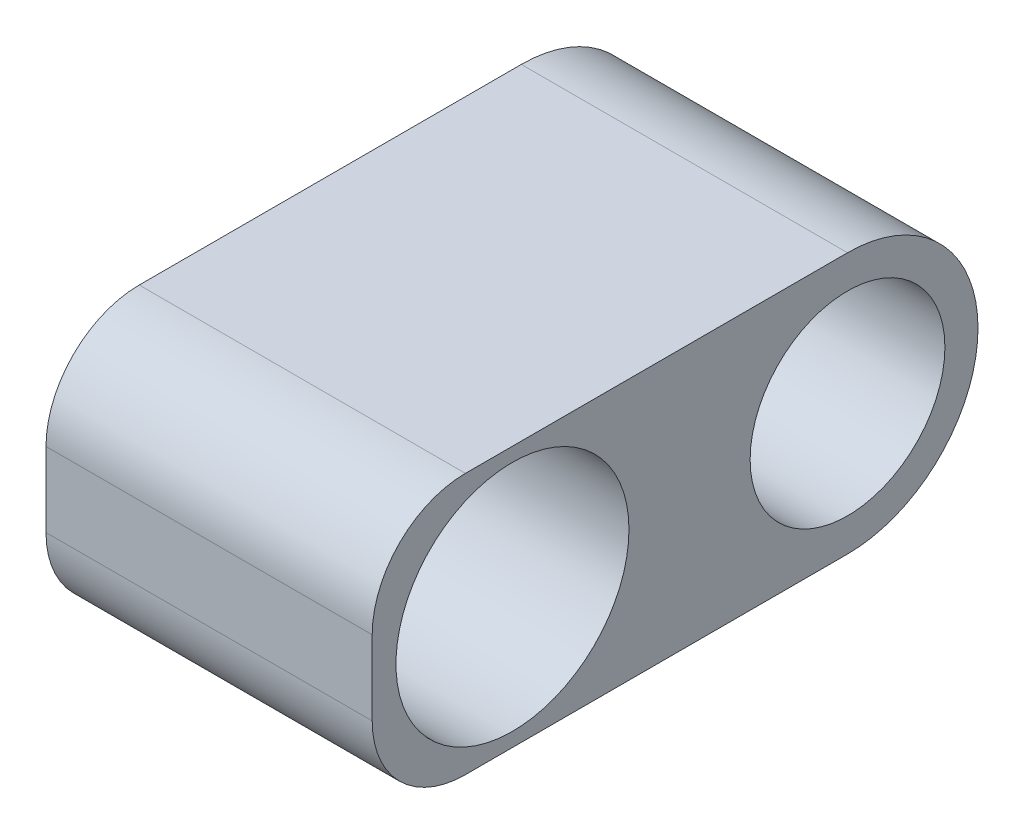
from build123d import *

# Parameters (mm, degrees)
BOSS_EXTRUDE1_START = -17
BOSS_EXTRUDE1_DEPTH = 35
SKETCH2_R           = 10.45
CUT_EXTRUDE1_DEPTH  = 32
SKETCH3_R           = 6.5
CUT_EXTRUDE2_DEPTH  = 62.814237842
SKETCH4_R           = 12.5
CUT_EXTRUDE3_DEPTH  = 64.419239983
FILLET5_R           = 10
FILLET6_R           = 10


with BuildPart() as part:
    # Sketch1 → Boss-Extrude1 (new body)
    with BuildSketch(Plane.YZ.offset(BOSS_EXTRUDE1_START)):
        with BuildLine():
            Line((-14, 0), (-14, 51))
            Line((-14, 51), (14, 51))
            Line((14, 51), (14, 0))
            ThreePointArc((14, 0), (0, -14), (-14, 0))
        make_face()
    extrude(amount=BOSS_EXTRUDE1_DEPTH)

    # Sketch2 → Cut-Extrude1 (cut)
    with BuildSketch(Plane.YZ.offset(18)):
        with Locations(Location((0, 0, 0), (0, 0, 270))):
            Circle(SKETCH2_R)
    extrude(amount=-CUT_EXTRUDE1_DEPTH, mode=Mode.SUBTRACT)

    # Sketch3 → Cut-Extrude2 (cut, through all)
    with BuildSketch(Plane.YZ.offset(-14)):
        with Locations(Location((0, 0, 0), (0, 0, 270))):
            Circle(SKETCH3_R)
    extrude(amount=-CUT_EXTRUDE2_DEPTH, mode=Mode.SUBTRACT)

    # Sketch4 → Cut-Extrude3 (cut, through all)
    with BuildSketch(Plane.YZ.offset(18)):
        with Locations(Location((0, 35.95, 0), (0, 0, 270))):
            Circle(SKETCH4_R)
    extrude(amount=-CUT_EXTRUDE3_DEPTH, mode=Mode.SUBTRACT)

    # Fillet5
    fillet5_edges = [part.edges().sort_by_distance(p)[0] for p in [
        (0.5, 14, 51),
    ]]
    fillet(fillet5_edges, radius=FILLET5_R)

    # Fillet6
    fillet6_edges = [part.edges().sort_by_distance(p)[0] for p in [
        (0.5, -14, 51),
    ]]
    fillet(fillet6_edges, radius=FILLET6_R)


solid = part.part
